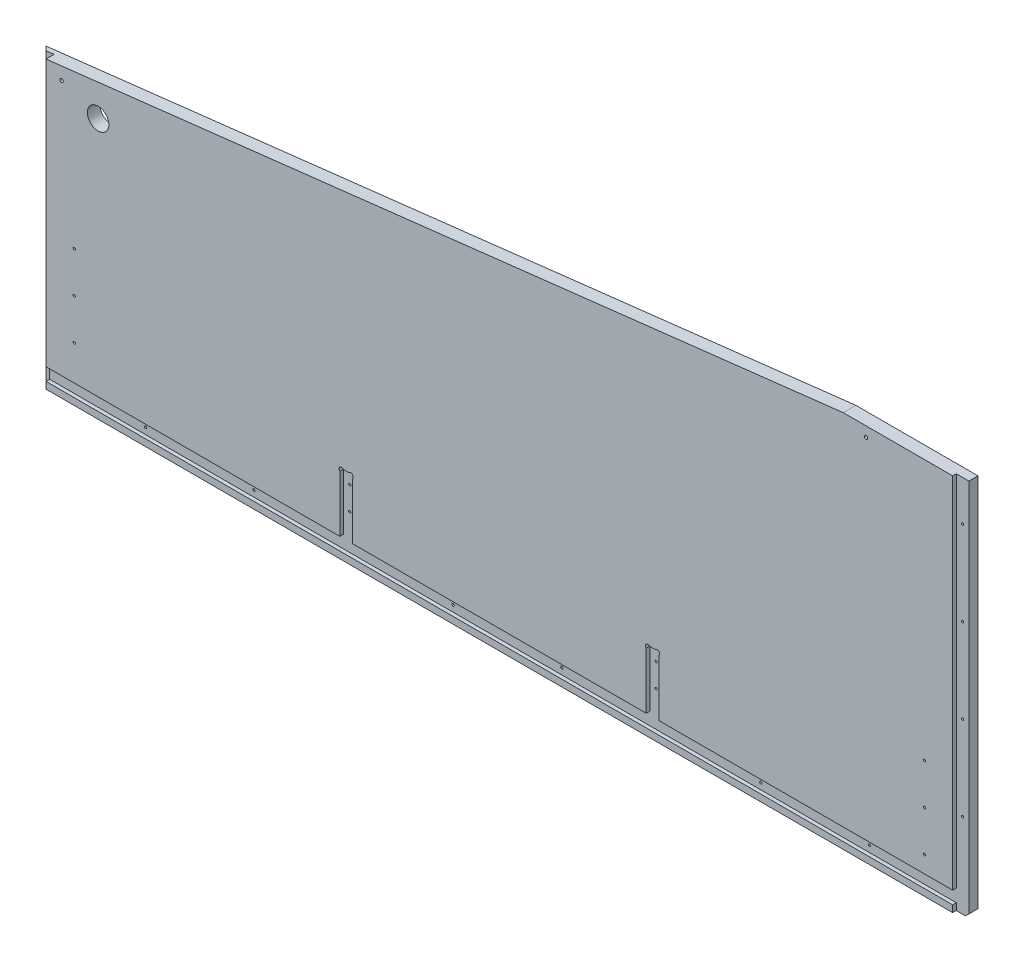
from build123d import *

# Parameters (mm, degrees)
EXTRUDE1_DEPTH     = 17.78
CUT_EXTRUDE1_DEPTH = 5.08
SKETCH4_W          = 17.78
SKETCH4_H          = 401.3161961
CUT_EXTRUDE2_DEPTH = 11.43
SKETCH5_R          = 15.08125
SKETCH5_R_2        = 1.5875
CUT_EXTRUDE3_DEPTH = 17.78
SKETCH6_R          = 3.302
CUT_EXTRUDE4_DEPTH = 5.08
CUT_EXTRUDE5_REACH = 12267.951
SKETCH8_R          = 2.38125
CUT_EXTRUDE6_DEPTH = 17.78


with BuildPart() as part:
    # Sketch2 → Extrude1 (new body)
    with BuildSketch(Plane.XY):
        Polygon((10946.341666666, -4853.78125), (10946.341666666, -5248.275), (10951.104166666, -5253.0375), (12249.679166666, -5253.0375), (12254.441666666, -5248.275), (12254.441666666, -4722.091838581), (12082.991666666, -4722.091838581), align=None)
    extrude(amount=-EXTRUDE1_DEPTH)

    # Sketch3 → Cut-Extrude1 (cut)
    with BuildSketch(Plane.XY):
        Polygon((10946.341666666, -5225.7325), (10946.341666666, -5243.5125), (12236.661666666, -5243.5125), (12236.661666666, -5253.0375), (12254.441666666, -5253.0375), (12254.441666666, -4722.091838581), (12236.661666666, -4722.091838581), (12236.661666666, -5225.7325), (11824.335, -5225.7325), (11824.335, -5141.9125), (11806.555, -5141.9125), (11806.555, -5225.7325), (11394.228333334, -5225.7325), (11394.228333334, -5141.912499999), (11376.448333334, -5141.9125), (11376.448333334, -5225.7325), align=None)
    extrude(amount=-CUT_EXTRUDE1_DEPTH, mode=Mode.SUBTRACT)

    # Sketch4 → Cut-Extrude2 (cut)
    with BuildSketch(Plane.XY):
        with Locations((10955.231666666, -5052.37940195)):
            Rectangle(SKETCH4_W, SKETCH4_H)
    extrude(amount=-CUT_EXTRUDE2_DEPTH, mode=Mode.SUBTRACT)

    # Sketch5 → Cut-Extrude3 (cut)
    with BuildSketch(Plane.XY):
        with Locations((11037.231463428, -4887.549352662)):
            Circle(SKETCH5_R)
        with Locations((10955.231666666, -4929.98125)):
            Circle(SKETCH5_R_2)
        with Locations((10955.231666666, -5031.58125)):
            Circle(SKETCH5_R_2)
        with Locations((11003.809166666, -5062.5375)):
            Circle(SKETCH5_R_2)
        with Locations((11003.809166666, -5119.6875)):
            Circle(SKETCH5_R_2)
        with Locations((11003.809166666, -5176.8375)):
            Circle(SKETCH5_R_2)
        with Locations((11251.141666666, -5234.6225)):
            Circle(SKETCH5_R_2)
        with Locations((11098.741666666, -5234.6225)):
            Circle(SKETCH5_R_2)
        with Locations((11385.338333334, -5160.9625)):
            Circle(SKETCH5_R_2)
        with Locations((11385.338333334, -5193.9825)):
            Circle(SKETCH5_R_2)
        with Locations((11530.541666666, -5234.6225)):
            Circle(SKETCH5_R_2)
        with Locations((11682.941666666, -5234.6225)):
            Circle(SKETCH5_R_2)
        with Locations((11815.445, -5160.9625)):
            Circle(SKETCH5_R_2)
        with Locations((11815.445, -5193.9825)):
            Circle(SKETCH5_R_2)
        with Locations((11962.341666666, -5234.6225)):
            Circle(SKETCH5_R_2)
        with Locations((12114.741666666, -5234.6225)):
            Circle(SKETCH5_R_2)
        with Locations((12196.974166666, -5202.2375)):
            Circle(SKETCH5_R_2)
        with Locations((12196.974166666, -5145.0875)):
            Circle(SKETCH5_R_2)
        with Locations((12245.551666666, -5134.504166666)):
            Circle(SKETCH5_R_2)
        with Locations((12196.974166666, -5087.9375)):
            Circle(SKETCH5_R_2)
        with Locations((12245.551666666, -5015.970833334)):
            Circle(SKETCH5_R_2)
        with Locations((12245.551666666, -4897.4375)):
            Circle(SKETCH5_R_2)
        with Locations((12245.551666666, -4778.904166666)):
            Circle(SKETCH5_R_2)
    extrude(amount=-CUT_EXTRUDE3_DEPTH, mode=Mode.SUBTRACT)

    # Sketch6 → Cut-Extrude4 (cut)
    with BuildSketch(Plane.XY):
        with Locations((11378.693397364, -5144.15756403)):
            Circle(SKETCH6_R)
        with Locations((11391.983269304, -5144.157564029)):
            Circle(SKETCH6_R)
        with Locations((11808.80006403, -5144.15756403)):
            Circle(SKETCH6_R)
        with Locations((11822.08993597, -5144.15756403)):
            Circle(SKETCH6_R)
    extrude(amount=-CUT_EXTRUDE4_DEPTH, mode=Mode.SUBTRACT)

    # Cut-Extrude5: up to this plane
    cut_extrude5_end = Plane(origin=(12082.991666666, -4722.091838581, -17.78), z_dir=(-0.11508765240352697, 0.993355340381399, 0))
    # Sketch7 → Cut-Extrude5 (cut, up to the surface)
    with BuildSketch(Plane.XZ.offset(5253.0375), mode=Mode.PRIVATE) as cut_extrude5_sk1:
        Polygon((10946.341666666, -17.78), (10946.341666666, -11.43), (10952.691666666, -11.43), align=None)
    cut_extrude5_tool1 = split(extrude(cut_extrude5_sk1.sketch, amount=-CUT_EXTRUDE5_REACH, mode=Mode.PRIVATE), bisect_by=cut_extrude5_end, keep=Keep.BOTH, mode=Mode.PRIVATE)
    add(cut_extrude5_tool1.solids().sort_by_distance((10948.458333, -5253.0375, -13.546667))[0], mode=Mode.SUBTRACT)

    # Sketch8 → Cut-Extrude6 (cut)
    with BuildSketch(Plane(origin=(0, 0, -17.78), x_dir=(-1, 0, 0), z_dir=(0, 0, -1))):
        with Locations((-10985.978050724, -4866.940983559)):
            Circle(SKETCH8_R)
        with Locations((-12115.075398369, -4736.126603454)):
            Circle(SKETCH8_R)
    extrude(amount=-CUT_EXTRUDE6_DEPTH, mode=Mode.SUBTRACT)


solid = part.part
